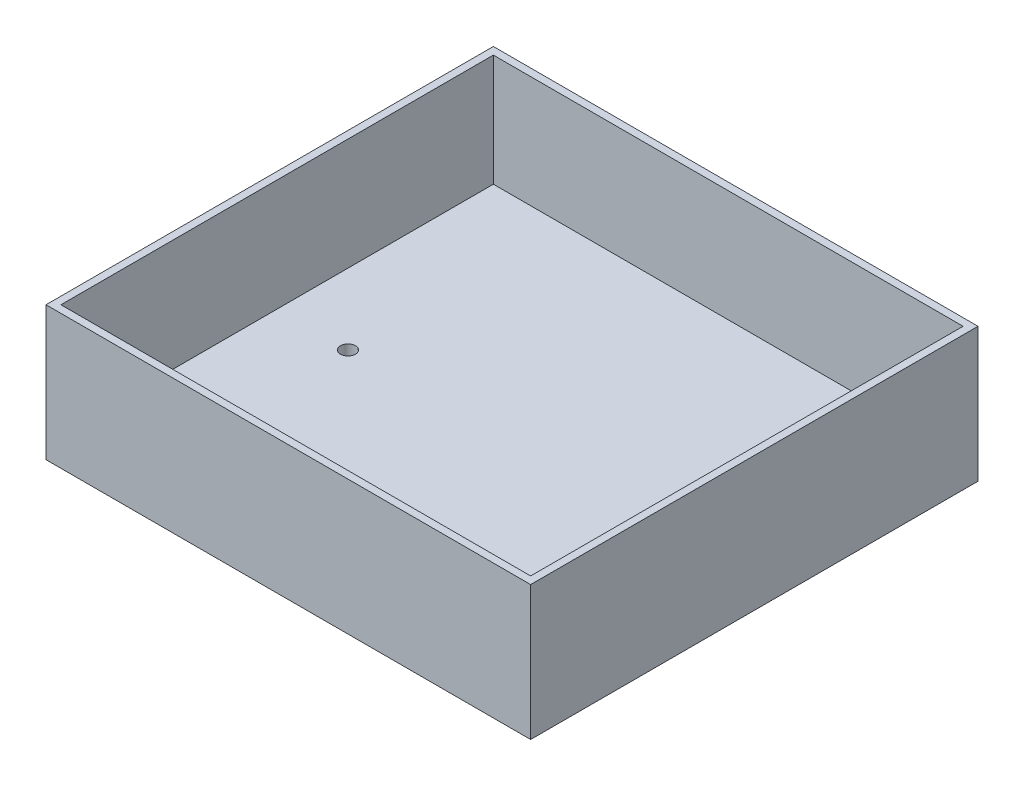
from build123d import *

# Parameters (mm, degrees)
SKETCH1_W                 = 65
SKETCH1_H                 = 60
BOSS_EXTRUDE1_DEPTH       = 18
SHELL1_T                  = -3
SHELL1_THICKNESS_2_FACE_W = 59
SHELL1_THICKNESS_2_FACE_H = 15
SHELL1_THICKNESS_2_DEPTH  = 2
SHELL1_THICKNESS_3_FACE_W = 56
SHELL1_THICKNESS_3_FACE_H = 15
SHELL1_THICKNESS_3_DEPTH  = 2
SHELL1_THICKNESS_4_FACE_W = 56
SHELL1_THICKNESS_4_FACE_H = 15
SHELL1_THICKNESS_4_DEPTH  = 2
SHELL1_THICKNESS_5_FACE_W = 63
SHELL1_THICKNESS_5_FACE_H = 15
SHELL1_THICKNESS_5_DEPTH  = 2
F_2_0MM_DOWEL_HOLE1_D     = 2


with BuildPart() as part:
    # Sketch1 → Boss-Extrude1 (new body)
    with BuildSketch(Plane(origin=(0, 0, 0), x_dir=(1, 0, 0), z_dir=(0, 1, 0))):
        Rectangle(SKETCH1_W, SKETCH1_H)
    extrude(amount=BOSS_EXTRUDE1_DEPTH)

    # Shell1
    shell1_openings = [part.faces().sort_by_distance(p)[0] for p in [
        (0, 18, 0),
    ]]
    offset(amount=SHELL1_T, openings=shell1_openings, kind=Kind.INTERSECTION)

    # Shell1 thickness 2 face (on inner face of the shell) → Shell1 thickness 2 (cut)
    with BuildSketch(Plane(origin=(0, 10.5, 27), x_dir=(1, 0, 0), z_dir=(0, 0, 1))):
        Rectangle(SHELL1_THICKNESS_2_FACE_W, SHELL1_THICKNESS_2_FACE_H)
    extrude(amount=SHELL1_THICKNESS_2_DEPTH, mode=Mode.SUBTRACT)

    # Shell1 thickness 3 face (on inner face of the shell) → Shell1 thickness 3 (cut)
    with BuildSketch(Plane(origin=(29.5, 10.5, 1), x_dir=(0, 0, 1), z_dir=(1, 0, 0))):
        Rectangle(SHELL1_THICKNESS_3_FACE_W, SHELL1_THICKNESS_3_FACE_H)
    extrude(amount=SHELL1_THICKNESS_3_DEPTH, mode=Mode.SUBTRACT)

    # Shell1 thickness 4 face (on inner face of the shell) → Shell1 thickness 4 (cut)
    with BuildSketch(Plane(origin=(-29.5, 10.5, 1), x_dir=(0, 0, -1), z_dir=(-1, 0, 0))):
        Rectangle(SHELL1_THICKNESS_4_FACE_W, SHELL1_THICKNESS_4_FACE_H)
    extrude(amount=SHELL1_THICKNESS_4_DEPTH, mode=Mode.SUBTRACT)

    # Shell1 thickness 5 face (on inner face of the shell) → Shell1 thickness 5 (cut)
    with BuildSketch(Plane(origin=(0, 10.5, -27), x_dir=(-1, 0, 0), z_dir=(0, 0, -1))):
        Rectangle(SHELL1_THICKNESS_5_FACE_W, SHELL1_THICKNESS_5_FACE_H)
    extrude(amount=SHELL1_THICKNESS_5_DEPTH, mode=Mode.SUBTRACT)

    # Ø2.0mm Dowel Hole1 (through all)
    with Locations(Plane(origin=(0, 3, 0), x_dir=(1, 0, 0), z_dir=(0, 1, 0))):
        with Locations((-22, 0), (22, 0)):
            Hole(F_2_0MM_DOWEL_HOLE1_D / 2)


solid = part.part
